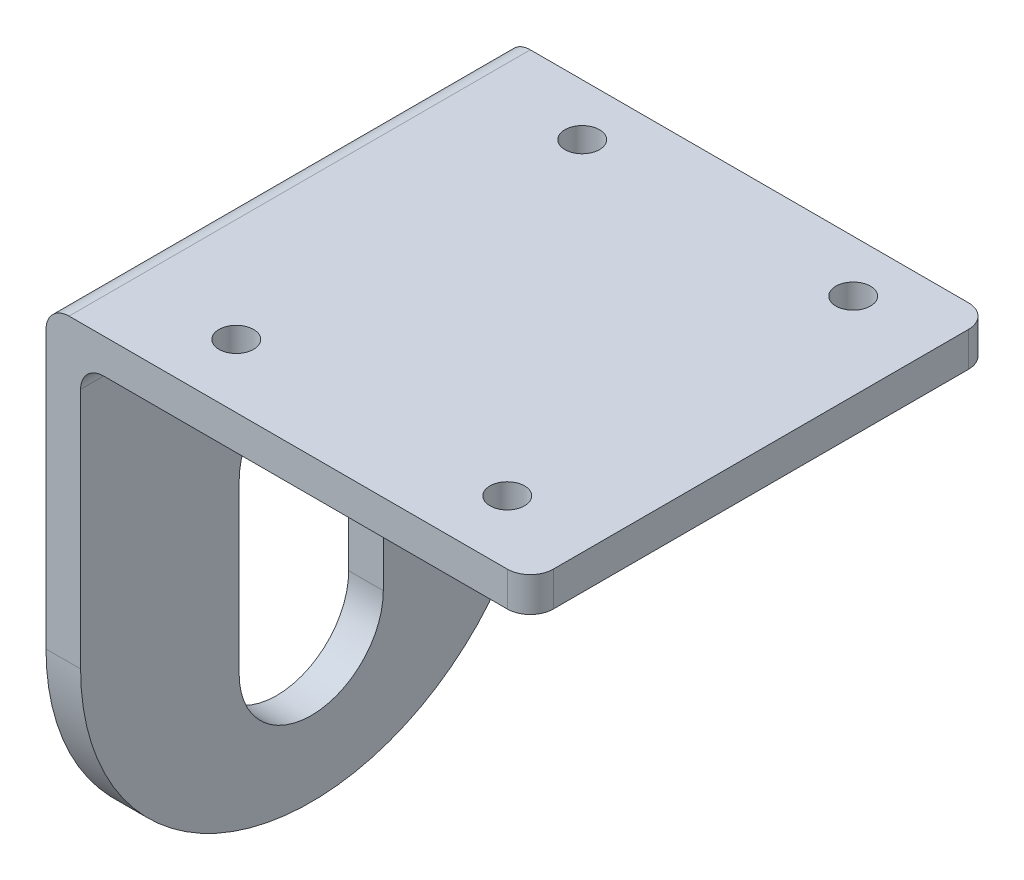
from build123d import *

# Parameters (mm, degrees)
SKETCH1_R           = 1.5
BOSS_EXTRUDE1_DEPTH = 3
SKETCH2_W           = 40
SKETCH2_H           = 3
CUT_EXTRUDE1_DEPTH  = 3
BOSS_EXTRUDE2_DEPTH = 3
FILLET1_R           = 2
FILLET2_R           = 2


with BuildPart() as part:
    # Sketch1 → Boss-Extrude1 (new body)
    with BuildSketch(Plane(origin=(0, 0, 0), x_dir=(1, 0, 0), z_dir=(0, 1, 0))):
        with BuildLine():
            Line((-19, -20), (19, -20))
            ThreePointArc((19, -20), (20.414213562, -19.414213562), (21, -18))
            Line((21, -18), (21, 18))
            ThreePointArc((21, 18), (20.414213562, 19.414213562), (19, 20))
            Line((19, 20), (-19, 20))
            Line((-19, 20), (-21, 20))
            Line((-21, 20), (-21, 18))
            Line((-21, 18), (-21, -18))
            Line((-21, -18), (-21, -20))
            Line((-21, -20), (-19, -20))
        make_face()
        with Locations(Location((13.5, 15.5, 0), (0, 0, 270))):
            Circle(SKETCH1_R, mode=Mode.SUBTRACT)
        with Locations(Location((-10, 15.5, 0), (0, 0, 270))):
            Circle(SKETCH1_R, mode=Mode.SUBTRACT)
        with Locations(Location((-10, -14.5, 0), (0, 0, 270))):
            Circle(SKETCH1_R, mode=Mode.SUBTRACT)
        with Locations(Location((13.5, -14.5, 0), (0, 0, 270))):
            Circle(SKETCH1_R, mode=Mode.SUBTRACT)
    extrude(amount=BOSS_EXTRUDE1_DEPTH)

    # Sketch2 → Cut-Extrude1 (cut)
    with BuildSketch(Plane.ZY.offset(21)):
        with Locations((0, 1.5)):
            Rectangle(SKETCH2_W, SKETCH2_H)
    extrude(amount=-CUT_EXTRUDE1_DEPTH, mode=Mode.SUBTRACT)

    # Sketch3 → Boss-Extrude2 (add)
    with BuildSketch(Plane.ZY.offset(18)):
        with BuildLine():
            Line((-20, 3), (20, 3))
            Line((20, 3), (20, -23))
            ThreePointArc((20, -23), (0, -43), (-20, -23))
            Line((-20, -23), (-20, 3))
        make_face()
        with BuildLine():
            Line((-6.25, -30.25), (-6.25, -15.75))
            ThreePointArc((-6.25, -15.75), (0, -9.5), (6.25, -15.75))
            Line((6.25, -15.75), (6.25, -30.25))
            ThreePointArc((6.25, -30.25), (0, -36.5), (-6.25, -30.25))
        make_face(mode=Mode.SUBTRACT)
    extrude(amount=BOSS_EXTRUDE2_DEPTH)

    # Fillet1
    fillet1_edges = [part.edges().sort_by_distance(p)[0] for p in [
        (-21, 3, 0),
    ]]
    fillet(fillet1_edges, radius=FILLET1_R)

    # Fillet2
    fillet2_edges = [part.edges().sort_by_distance(p)[0] for p in [
        (-18, 0, 0),
    ]]
    fillet(fillet2_edges, radius=FILLET2_R)


solid = part.part
